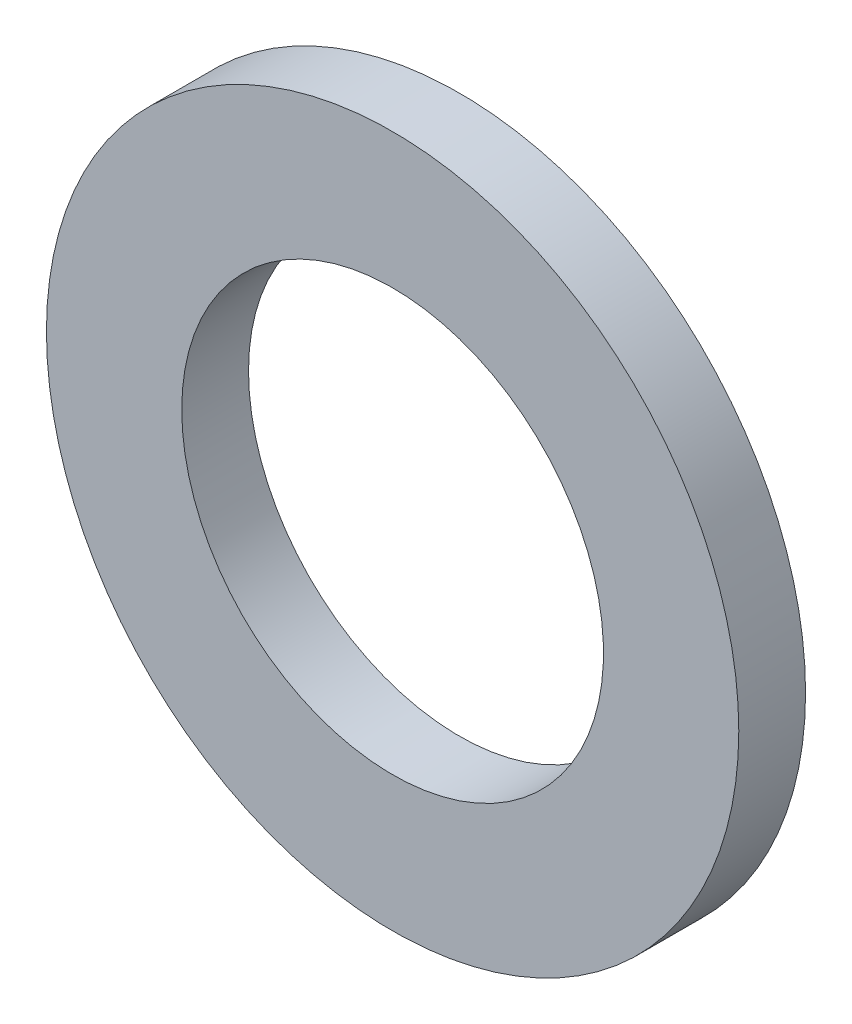
from build123d import *

# Parameters (mm, degrees)
SKIZZE1_R                       = 4.925
SKIZZE1_R_2                     = 3
AUFSATZ_LINEAR_AUSTRAGEN1_DEPTH = 0.95


with BuildPart() as part:
    # Skizze1 → Aufsatz-Linear austragen1 (new body)
    with BuildSketch(Plane.XY):
        with Locations(Location((0, 0, 0), (0, 0, 180))):
            Circle(SKIZZE1_R)
        with Locations(Location((0, 0, 0), (0, 0, 180))):
            Circle(SKIZZE1_R_2, mode=Mode.SUBTRACT)
    extrude(amount=AUFSATZ_LINEAR_AUSTRAGEN1_DEPTH)


solid = part.part
